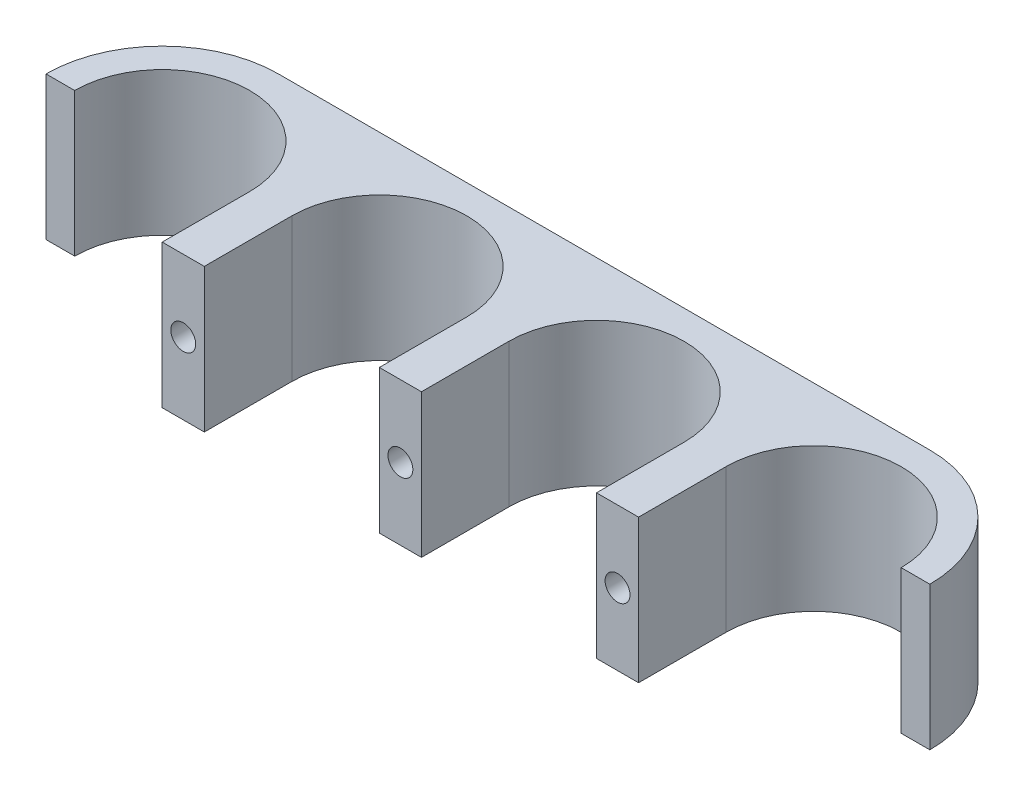
from build123d import *

# Parameters (mm, degrees)
BOSS_EXTRUDE1_DEPTH  = 15
M2_CLEARANCE_HOLE2_D = 2.6


with BuildPart() as part:
    # Sketch1 → Boss-Extrude1 (new body)
    with BuildSketch(Plane(origin=(0, 0, 0), x_dir=(1, 0, 0), z_dir=(0, 1, 0))):
        with BuildLine():
            Line((2.2, 0), (2.2, -9.15))
            Line((2.2, -9.15), (-2.2, -9.15))
            Line((-2.2, -9.15), (-2.2, 0))
            ThreePointArc((-2.2, 0), (-11.35, 9.15), (-20.5, 0))
            Line((-20.5, 0), (-20.5, -9.15))
            Line((-20.5, -9.15), (-24.9, -9.15))
            Line((-24.9, -9.15), (-24.9, 0))
            ThreePointArc((-24.9, 0), (-34.05, 9.15), (-43.2, 0))
            Line((-43.2, 0), (-46.2, 0))
            ThreePointArc((-46.2, 0), (-42.641347391, 8.591347391), (-34.05, 12.15))
            Line((-34.05, 12.15), (34.05, 12.15))
            ThreePointArc((34.05, 12.15), (42.641347391, 8.591347391), (46.2, 0))
            Line((46.2, 0), (43.2, 0))
            ThreePointArc((43.2, 0), (34.05, 9.15), (24.9, 0))
            Line((24.9, 0), (24.9, -9.15))
            Line((24.9, -9.15), (20.5, -9.15))
            Line((20.5, -9.15), (20.5, 0))
            ThreePointArc((20.5, 0), (11.35, 9.15), (2.2, 0))
        make_face()
    extrude(amount=BOSS_EXTRUDE1_DEPTH)

    # M2 Clearance Hole2 (through all)
    with Locations(Plane(origin=(0, 0, -12.15), x_dir=(-1, 0, 0), z_dir=(0, 0, -1))):
        with Locations((0, 7.5), (-22.7, 7.5), (22.7, 7.5)):
            Hole(M2_CLEARANCE_HOLE2_D / 2)


solid = part.part
